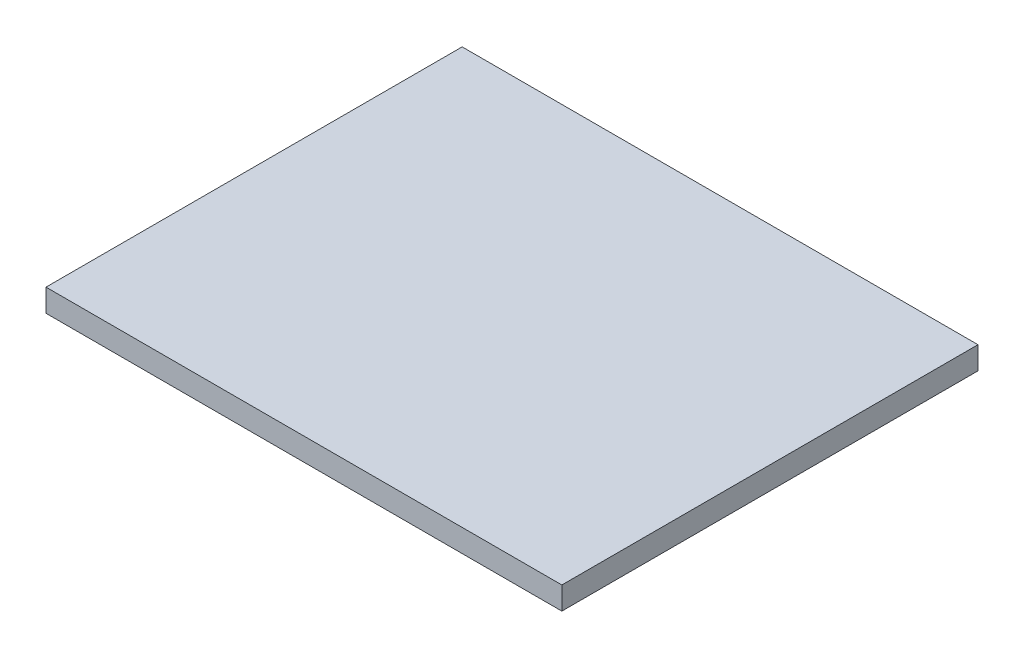
from build123d import *

# Parameters (mm, degrees)
SKETCH1_W           = 17.33514248
SKETCH1_H           = 13.98470303
BOSS_EXTRUDE1_DEPTH = 0.762


with BuildPart() as part:
    # Sketch1 → Boss-Extrude1 (new body)
    with BuildSketch(Plane(origin=(0, 0, 0), x_dir=(1, 0, 0), z_dir=(0, 1, 0))):
        Rectangle(SKETCH1_W, SKETCH1_H)
    extrude(amount=BOSS_EXTRUDE1_DEPTH)


solid = part.part
